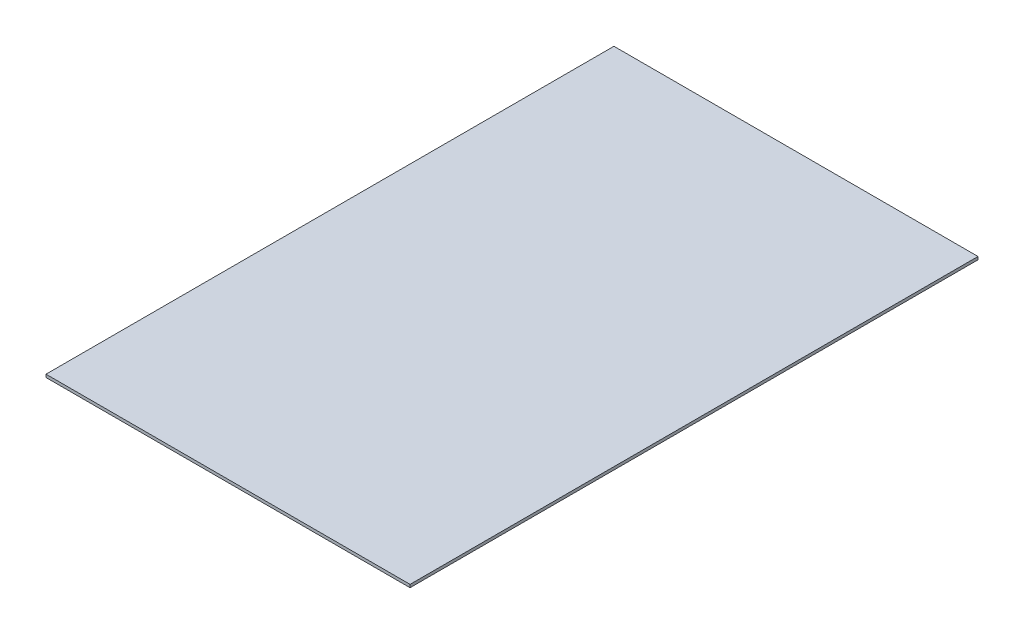
from build123d import *

# Parameters (mm, degrees)
SKETCH1_W           = 317.5
SKETCH1_H           = 495.3
BOSS_EXTRUDE1_DEPTH = 2.54


with BuildPart() as part:
    # Sketch1 → Boss-Extrude1 (new body)
    with BuildSketch(Plane(origin=(0, 0, 0), x_dir=(1, 0, 0), z_dir=(0, 1, 0))):
        Rectangle(SKETCH1_W, SKETCH1_H)
    extrude(amount=BOSS_EXTRUDE1_DEPTH)


solid = part.part
